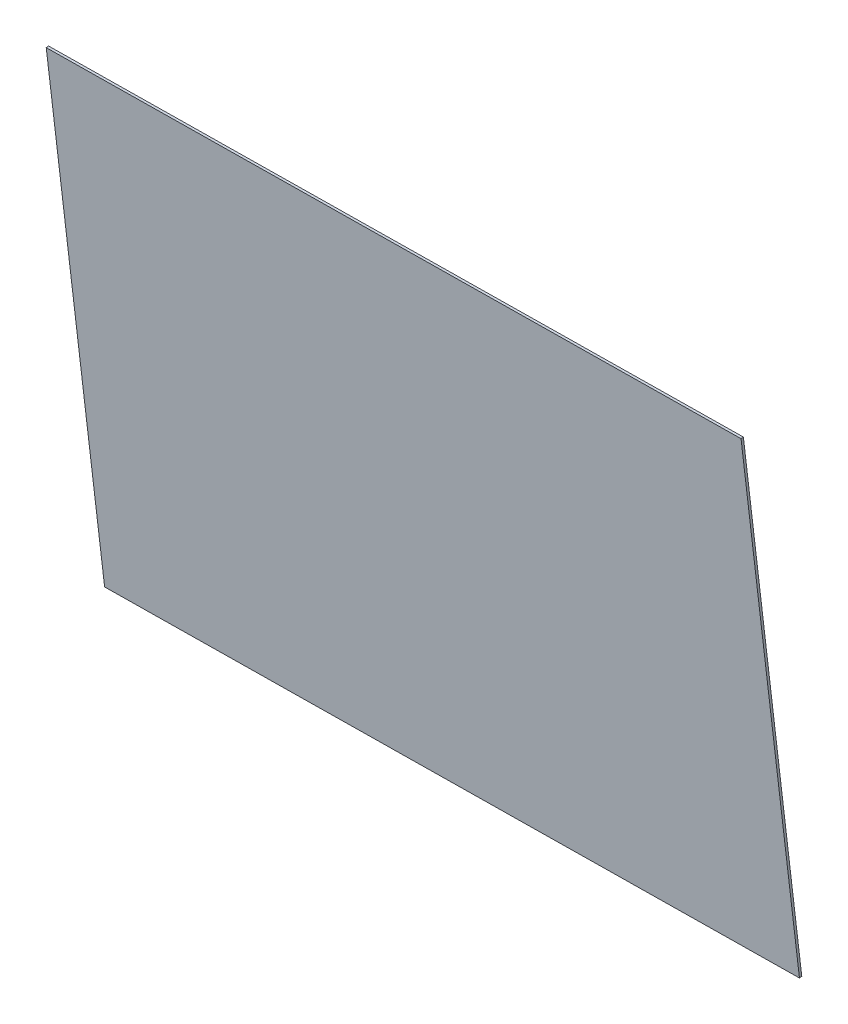
from build123d import *

# Parameters (mm, degrees)
BOSS_EXTRUDE1_DEPTH = 1


with BuildPart() as part:
    # Sketch1 → Boss-Extrude1 (new body)
    with BuildSketch(Plane(origin=(0, 20.999981026, -199.801473017), x_dir=(1, 0, 0), z_dir=(0, -0.10452846326765333, 0.9945218953682734))):
        Polygon((131.091798874, -701.955159087), (428.061963555, -697.745492933), (431.038495179, -907.724397253), (134.068330498, -911.934063407), align=None)
    extrude(amount=BOSS_EXTRUDE1_DEPTH)


solid = part.part
